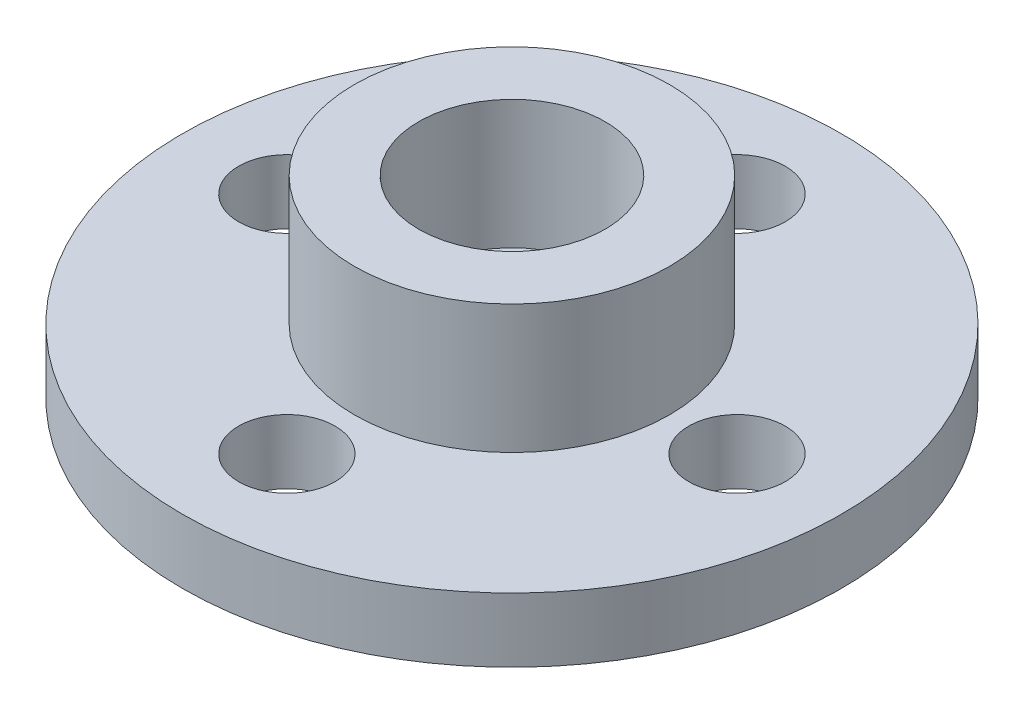
from build123d import *

# Parameters (mm, degrees)
SKETCH1_R           = 10.25
BOSS_EXTRUDE1_DEPTH = 2
SKETCH2_R           = 1.5
CUT_EXTRUDE1_DEPTH  = 3
SKETCH3_R           = 4.9
SKETCH3_R_2         = 2.9
BOSS_EXTRUDE2_DEPTH = 4


with BuildPart() as part:
    # Sketch1 → Boss-Extrude1 (new body)
    with BuildSketch(Plane(origin=(0, 0, 0), x_dir=(1, 0, 0), z_dir=(0, 1, 0))):
        with Locations(Location((0, 0, 0), (0, 0, 270))):
            Circle(SKETCH1_R)
    extrude(amount=BOSS_EXTRUDE1_DEPTH)

    # Sketch2 → Cut-Extrude1 (cut)
    with BuildSketch(Plane(origin=(0, 2, 0), x_dir=(1, 0, 0), z_dir=(0, 1, 0))):
        with Locations(Location((7, 0, 0), (0, 0, 270))):
            Circle(SKETCH2_R)
        with Locations(Location((0, 0, 0), (0, 0, 270))):
            Circle(SKETCH2_R)
        with Locations(Location((0, 7, 0), (0, 0, 270))):
            Circle(SKETCH2_R)
        with Locations(Location((-7, 0, 0), (0, 0, 270))):
            Circle(SKETCH2_R)
        with Locations(Location((0, -7, 0), (0, 0, 270))):
            Circle(SKETCH2_R)
    extrude(amount=-CUT_EXTRUDE1_DEPTH, mode=Mode.SUBTRACT)

    # Sketch3 → Boss-Extrude2 (add)
    with BuildSketch(Plane(origin=(0, 2, 0), x_dir=(1, 0, 0), z_dir=(0, 1, 0))):
        with Locations(Location((0, 0, 0), (0, 0, 270))):
            Circle(SKETCH3_R)
        with Locations(Location((0, 0, 0), (0, 0, 270))):
            Circle(SKETCH3_R_2, mode=Mode.SUBTRACT)
    extrude(amount=BOSS_EXTRUDE2_DEPTH)


solid = part.part
